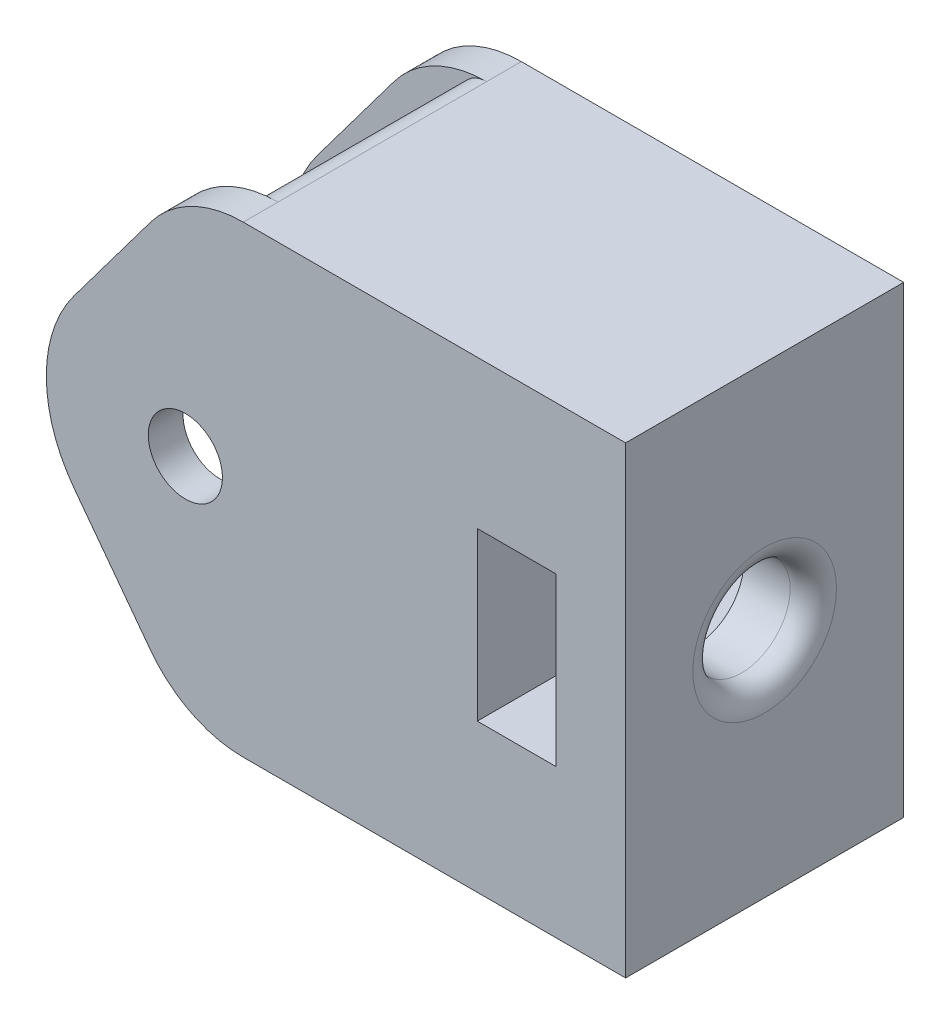
from build123d import *

# Parameters (mm, degrees)
SKETCH_1_R          = 1.6
SKETCH_1_W          = 3.4
SKETCH_1_H          = 7.2
EXTRUDE_1_DEPTH     = 6
SKETCH_1_3_R        = 1.6
CUT_EXTRUDE_1_DEPTH = 4.5
SKETCH_2_R          = 2.1
CUT_EXTRUDE_2_DEPTH = 28.586228448
FILLET_1_R          = 1


with BuildPart() as part:
    # Эскиз1 → Бобышка-Вытянуть1 (new, symmetric)
    with BuildSketch(Plane.XY):
        with BuildLine():
            ThreePointArc((-1.5, -8), (0.263932023, -9.472135955), (2.5, -10))
            Line((2.5, -10), (19, -10))
            Line((19, -10), (19, 10))
            Line((19, 10), (2.5, 10))
            ThreePointArc((2.5, 10), (0.263932023, 9.472135955), (-1.5, 8))
            Line((-1.5, 8), (-4.8, 3.6))
            ThreePointArc((-4.8, 3.6), (-6, 0), (-4.8, -3.6))
            Line((-4.8, -3.6), (-1.5, -8))
        make_face()
        Circle(SKETCH_1_R, mode=Mode.SUBTRACT)
        with Locations((14.3, 0)):
            Rectangle(SKETCH_1_W, SKETCH_1_H, mode=Mode.SUBTRACT)
    extrude(amount=EXTRUDE_1_DEPTH, both=True)

    # Эскиз1<3> → Вырез-Вытянуть1 (cut, symmetric)
    with BuildSketch(Plane.XY):
        with BuildLine():
            ThreePointArc((2.18016654, 7.697199092), (1.337547263, 8.987840658), (2.5, 10))
            ThreePointArc((2.5, 10), (0.263932023, 9.472135955), (-1.5, 8))
            Line((-1.5, 8), (-4.8, 3.6))
            ThreePointArc((-4.8, 3.6), (-6, 0), (-4.8, -3.6))
            Line((-4.8, -3.6), (-1.5, -8))
            ThreePointArc((-1.5, -8), (0.263932023, -9.472135955), (2.5, -10))
            ThreePointArc((2.5, -10), (1.337547263, -8.987840658), (2.18016654, -7.697199092))
            ThreePointArc((2.18016654, -7.697199092), (8, 0), (2.18016654, 7.697199092))
        make_face()
        Circle(SKETCH_1_3_R, mode=Mode.SUBTRACT)
    extrude(amount=CUT_EXTRUDE_1_DEPTH, both=True, mode=Mode.SUBTRACT)

    # Эскиз2 → Вырез-Вытянуть2 (cut, through all)
    with BuildSketch(Plane(origin=(19, 0, 0), x_dir=(0, 0, -1), z_dir=(1, 0, 0))):
        Circle(SKETCH_2_R)
    extrude(amount=-CUT_EXTRUDE_2_DEPTH, mode=Mode.SUBTRACT)

    # Скругление1
    fillet_1_edges = [part.edges().sort_by_distance(p)[0] for p in [
        (7.999999993, 1e-09, 2.100000016),
        (19, 0, 2.1),
    ]]
    fillet(fillet_1_edges, radius=FILLET_1_R)


solid = part.part
